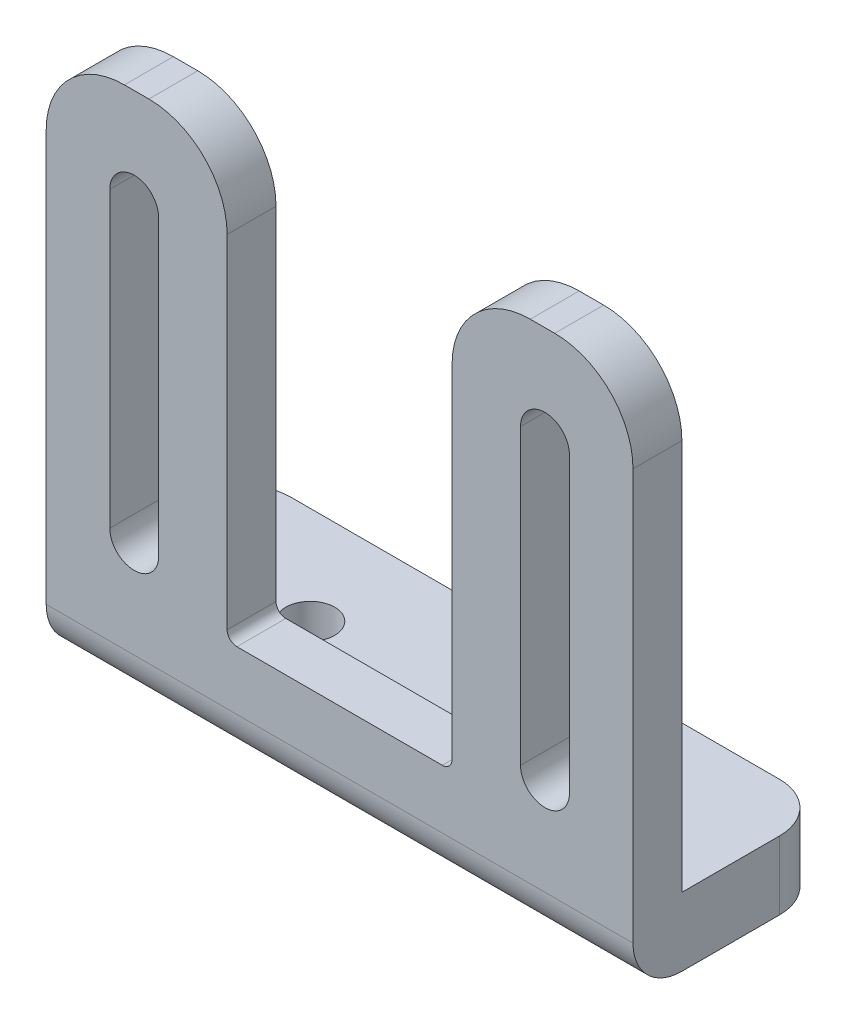
from build123d import *

# Parameters (mm, degrees)
SKETCH1_W           = 60
SKETCH1_H           = 55
BOSS_EXTRUDE1_DEPTH = 5
CUT_EXTRUDE1_REACH  = 83.548
SKETCH2_W           = 23
SKETCH2_H           = 44
SKETCH3_W           = 60
SKETCH3_H           = 7
BOSS_EXTRUDE2_DEPTH = 15
CUT_EXTRUDE2_REACH  = 80.288
SKETCH4_R           = 2.5
FILLET1_R           = 8
FILLET2_R           = 5
FILLET3_R           = 5
FILLET4_R           = 1


with BuildPart() as part:
    # Sketch1 → Boss-Extrude1 (new body)
    with BuildSketch(Plane.XY):
        with Locations((30, 27.5)):
            Rectangle(SKETCH1_W, SKETCH1_H)
    extrude(amount=BOSS_EXTRUDE1_DEPTH)

    # Sketch2 → Cut-Extrude1 (cut, up to next)
    with BuildSketch(Plane.XY.offset(5), mode=Mode.PRIVATE) as cut_extrude1_sk1:
        with BuildLine():
            Line((11.5, 45), (11.5, 15))
            ThreePointArc((11.5, 15), (9, 12.5), (6.5, 15))
            Line((6.5, 15), (6.5, 45))
            ThreePointArc((6.5, 45), (9, 47.5), (11.5, 45))
        make_face()
    cut_extrude1_tool1 = extrude(cut_extrude1_sk1.sketch, amount=-CUT_EXTRUDE1_REACH, mode=Mode.PRIVATE) & part.part
    # Sketch2 → Cut-Extrude1 (cut, up to next)
    with BuildSketch(Plane.XY.offset(5), mode=Mode.PRIVATE) as cut_extrude1_sk2:
        with BuildLine():
            Line((53.5, 45), (53.5, 15))
            ThreePointArc((53.5, 15), (51, 12.5), (48.5, 15))
            Line((48.5, 15), (48.5, 45))
            ThreePointArc((48.5, 45), (51, 47.5), (53.5, 45))
        make_face()
    cut_extrude1_tool2 = extrude(cut_extrude1_sk2.sketch, amount=-CUT_EXTRUDE1_REACH, mode=Mode.PRIVATE) & part.part
    # Sketch2 → Cut-Extrude1 (cut, up to next)
    with BuildSketch(Plane.XY.offset(5), mode=Mode.PRIVATE) as cut_extrude1_sk3:
        with Locations((30, 33)):
            Rectangle(SKETCH2_W, SKETCH2_H)
    cut_extrude1_tool3 = extrude(cut_extrude1_sk3.sketch, amount=-CUT_EXTRUDE1_REACH, mode=Mode.PRIVATE) & part.part
    add(cut_extrude1_tool1.solids().sort_by_distance((9, 30, 5))[0], mode=Mode.SUBTRACT)
    add(cut_extrude1_tool2.solids().sort_by_distance((51, 30, 5))[0], mode=Mode.SUBTRACT)
    add(cut_extrude1_tool3.solids().sort_by_distance((30, 33, 5))[0], mode=Mode.SUBTRACT)

    # Sketch3 → Boss-Extrude2 (add)
    with BuildSketch(Plane(origin=(0, 0, 0), x_dir=(-1, 0, 0), z_dir=(0, 0, -1))):
        with Locations((-30, 3.5)):
            Rectangle(SKETCH3_W, SKETCH3_H)
    extrude(amount=BOSS_EXTRUDE2_DEPTH)

    # Sketch4 → Cut-Extrude2 (cut, up to next)
    with BuildSketch(Plane(origin=(0, 7, 0), x_dir=(1, 0, 0), z_dir=(0, 1, 0)), mode=Mode.PRIVATE) as cut_extrude2_sk1:
        with Locations(Location((17, 5, 0), (0, 0, 180))):
            Circle(SKETCH4_R)
    cut_extrude2_tool1 = extrude(cut_extrude2_sk1.sketch, amount=-CUT_EXTRUDE2_REACH, mode=Mode.PRIVATE) & part.part
    # Sketch4 → Cut-Extrude2 (cut, up to next)
    with BuildSketch(Plane(origin=(0, 7, 0), x_dir=(1, 0, 0), z_dir=(0, 1, 0)), mode=Mode.PRIVATE) as cut_extrude2_sk2:
        with Locations(Location((43, 5, 0), (0, 0, 180))):
            Circle(SKETCH4_R)
    cut_extrude2_tool2 = extrude(cut_extrude2_sk2.sketch, amount=-CUT_EXTRUDE2_REACH, mode=Mode.PRIVATE) & part.part
    add(cut_extrude2_tool1.solids().sort_by_distance((17, 7, -5))[0], mode=Mode.SUBTRACT)
    add(cut_extrude2_tool2.solids().sort_by_distance((43, 7, -5))[0], mode=Mode.SUBTRACT)

    # Fillet1
    fillet1_edges = [part.edges().sort_by_distance(p)[0] for p in [
        (18.5, 55, 2.5),
        (41.5, 55, 2.5),
        (0, 55, 2.5),
        (60, 55, 2.5),
    ]]
    fillet(fillet1_edges, radius=FILLET1_R)

    # Fillet2
    fillet2_edges = [part.edges().sort_by_distance(p)[0] for p in [
        (0, 3.5, -15),
        (60, 3.5, -15),
    ]]
    fillet(fillet2_edges, radius=FILLET2_R)

    # Fillet3
    fillet3_edges = [part.edges().sort_by_distance(p)[0] for p in [
        (30, 0, 5),
    ]]
    fillet(fillet3_edges, radius=FILLET3_R)

    # Fillet4
    fillet4_edges = [part.edges().sort_by_distance(p)[0] for p in [
        (18.5, 11, 2.5),
        (41.5, 11, 2.5),
    ]]
    fillet(fillet4_edges, radius=FILLET4_R)


solid = part.part
